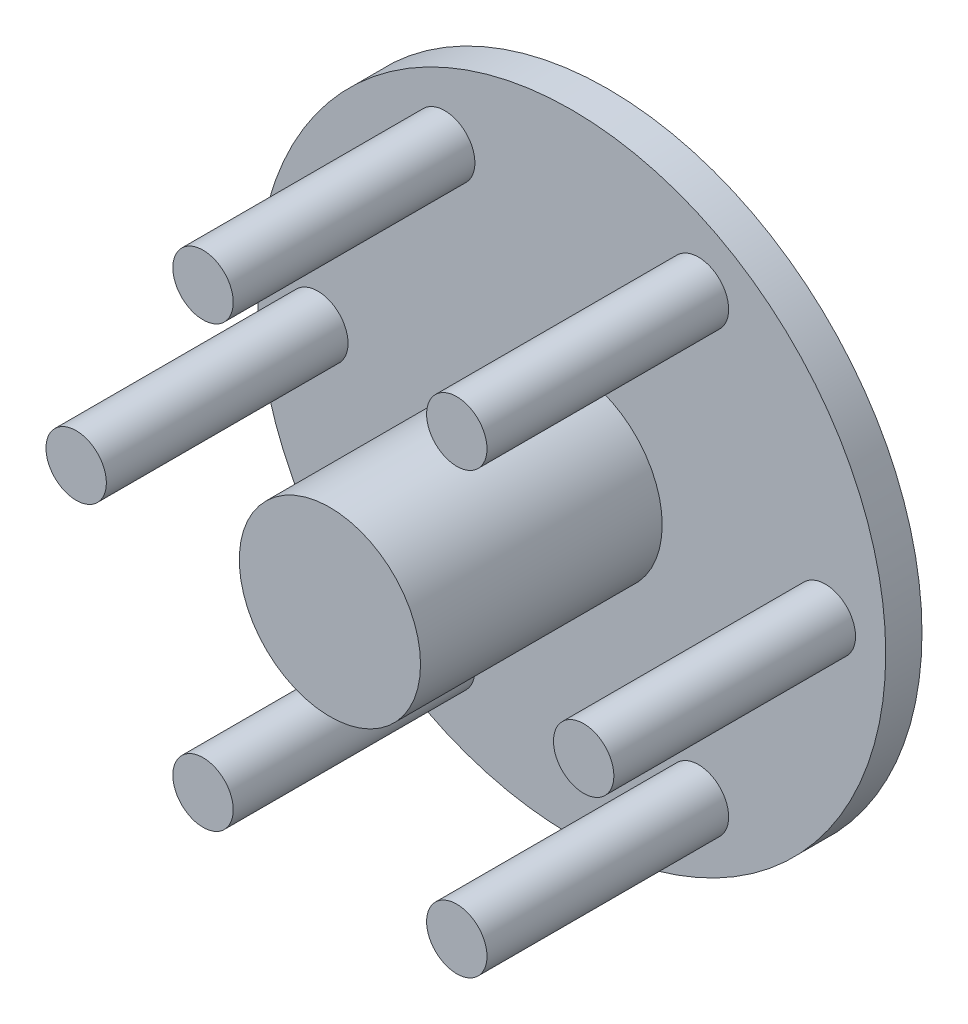
from build123d import *

# Parameters (mm, degrees)
SKETCH_1_R      = 26
EXTRUDE_1_DEPTH = 3
SKETCH_2_R      = 2.5
EXTRUDE_2_DEPTH = 20
SKETCH_3_R      = 7.5
EXTRUDE_3_DEPTH = 20


with BuildPart() as part:
    # 草图1 → 凸台-拉伸1 (new body)
    with BuildSketch(Plane.XY):
        Circle(SKETCH_1_R)
    extrude(amount=-EXTRUDE_1_DEPTH)

    # 草图2 → 凸台-拉伸2 (add)
    with BuildSketch(Plane.XY):
        with Locations((-21, 0)):
            Circle(SKETCH_2_R)
        with Locations((-10.5, 18.186533479)):
            Circle(SKETCH_2_R)
        with Locations((10.5, 18.186533479)):
            Circle(SKETCH_2_R)
        with Locations((21, 0)):
            Circle(SKETCH_2_R)
        with Locations((10.5, -18.186533479)):
            Circle(SKETCH_2_R)
        with Locations((-10.5, -18.186533479)):
            Circle(SKETCH_2_R)
    extrude(amount=EXTRUDE_2_DEPTH)

    # 草图3 → 凸台-拉伸3 (add)
    with BuildSketch(Plane.XY):
        Circle(SKETCH_3_R)
    extrude(amount=EXTRUDE_3_DEPTH)


solid = part.part
